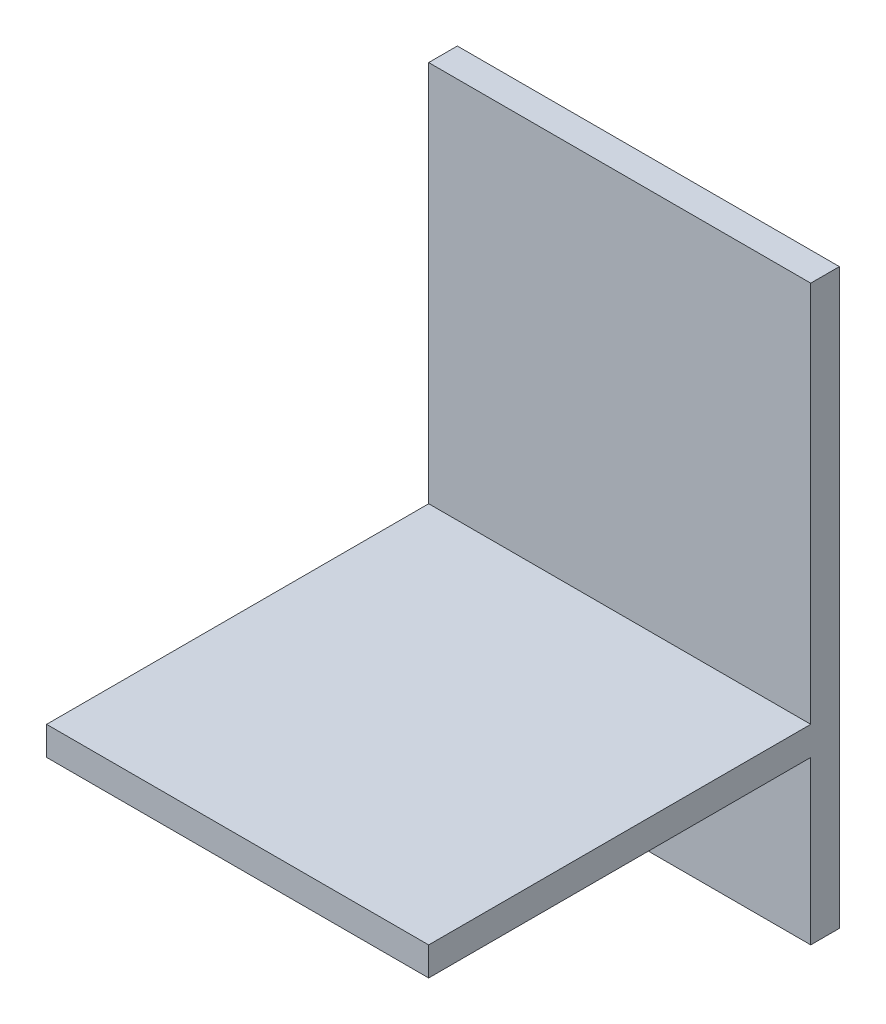
from build123d import *

# Parameters (mm, degrees)
SKETCH_1_W          = 40
SKETCH_1_H          = 60
EXTRUDE_1_DEPTH     = 3
SKETCH_2_W          = 40
SKETCH_2_H          = 3
EXTRUDE_2_DEPTH     = 40
EXTRUDE_3_DEPTH     = 23
CUT_EXTRUDE_1_DEPTH = 17


with BuildPart() as part:
    # 草图1 → 凸台-拉伸1 (new body)
    with BuildSketch(Plane.XY):
        with Locations((20, -30)):
            Rectangle(SKETCH_1_W, SKETCH_1_H)
    extrude(amount=EXTRUDE_1_DEPTH)

    # 草图2 → 凸台-拉伸2 (add)
    with BuildSketch(Plane.XY.offset(3)):
        with Locations((20, -41.5)):
            Rectangle(SKETCH_2_W, SKETCH_2_H)
    extrude(amount=EXTRUDE_2_DEPTH)

    # 草图3 → 凸台-拉伸3 (add)
    with BuildSketch(Plane.ZY):
        Polygon((3, -55), (28, -43), (3, -43), align=None)
    extrude(amount=-EXTRUDE_3_DEPTH)

    # 草图3<2> → 切除-拉伸1 (cut)
    with BuildSketch(Plane.ZY):
        Polygon((3, -55), (28, -43), (3, -43), align=None)
    extrude(amount=-CUT_EXTRUDE_1_DEPTH, mode=Mode.SUBTRACT)


solid = part.part
